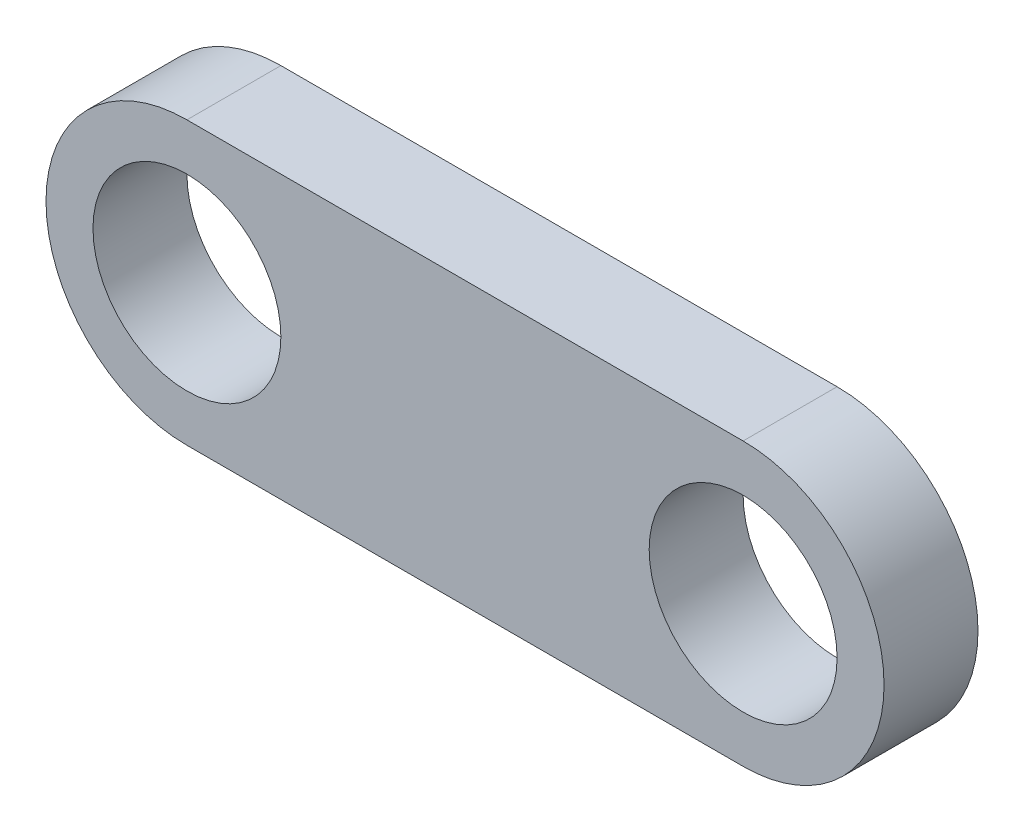
from build123d import *

# Parameters (mm, degrees)
SKETCH1_R           = 1
BOSS_EXTRUDE1_DEPTH = 0.5


with BuildPart() as part:
    # Sketch1 → Boss-Extrude1 (new, symmetric)
    with BuildSketch(Plane.XY):
        with BuildLine():
            Line((0, -1.5), (-5.92, -1.5))
            ThreePointArc((-5.92, -1.5), (-7.42, 0), (-5.92, 1.5))
            Line((-5.92, 1.5), (0, 1.5))
            ThreePointArc((0, 1.5), (1.5, 0), (0, -1.5))
        make_face()
        with Locations((-5.92, 0)):
            Circle(SKETCH1_R, mode=Mode.SUBTRACT)
        Circle(SKETCH1_R, mode=Mode.SUBTRACT)
    extrude(amount=BOSS_EXTRUDE1_DEPTH, both=True)


solid = part.part
